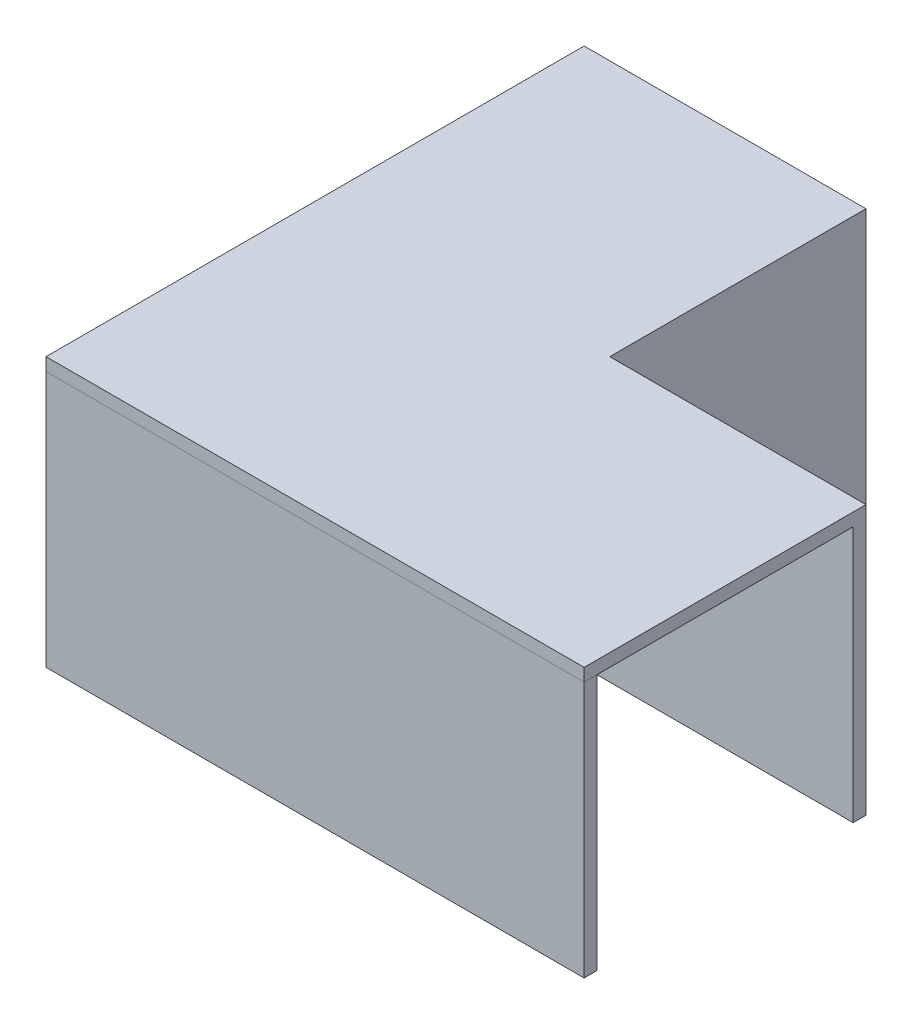
from build123d import *

# Parameters (mm, degrees)
BOSS_EXTRUDE1_DEPTH = 254
SKETCH2_W           = 254
SKETCH2_H           = 254
CUT_EXTRUDE1_DEPTH  = 254
SKETCH3_W           = 254
SKETCH3_H           = 254
CUT_EXTRUDE2_DEPTH  = 254
SKETCH4_W           = 254
SKETCH4_H           = 266.7
SKETCH4_H_2         = 12.7
BOSS_EXTRUDE2_DEPTH = 12.7


with BuildPart() as part:
    # Sketch1 → Boss-Extrude1 (new body)
    with BuildSketch(Plane(origin=(0, 0, 0), x_dir=(1, 0, 0), z_dir=(0, 1, 0))):
        Polygon((-12.7, -12.7), (520.7, -12.7), (520.7, 266.7), (266.7, 266.7), (266.7, 520.7), (-12.7, 520.7), align=None)
        Polygon((0, 0), (508, 0), (508, 254), (254, 254), (254, 508), (0, 508), align=None, mode=Mode.SUBTRACT)
    extrude(amount=BOSS_EXTRUDE1_DEPTH)

    # Sketch2 → Cut-Extrude1 (cut)
    with BuildSketch(Plane.ZY.offset(-508)):
        with Locations((-127, 127)):
            Rectangle(SKETCH2_W, SKETCH2_H)
    extrude(amount=-CUT_EXTRUDE1_DEPTH, mode=Mode.SUBTRACT)

    # Sketch3 → Cut-Extrude2 (cut)
    with BuildSketch(Plane.XY.offset(-508)):
        with Locations((127, 127)):
            Rectangle(SKETCH3_W, SKETCH3_H)
    extrude(amount=-CUT_EXTRUDE2_DEPTH, mode=Mode.SUBTRACT)


with BuildPart() as cut_extrude2_piece_1:
    # of the separate pieces the step leaves, piece 1, a body of its own (cut_extrude2_pieces)
    add(part.part.solids().sort_by_distance((-12.7, 0, 12.7))[0])


with BuildPart() as cut_extrude2_piece_2:
    # of the separate pieces the step leaves, piece 2, a body of its own (cut_extrude2_pieces)
    add(part.part.solids().sort_by_distance((266.7, 0, -520.7))[0])

    # Sketch4 → Boss-Extrude2 (add)
    with BuildSketch(Plane(origin=(0, 254, 0), x_dir=(1, 0, 0), z_dir=(0, 1, 0))):
        Polygon((266.7, 520.7), (0, 520.7), (0, 0), (266.7, 0), (266.7, 266.7), align=None)
        with Locations((393.7, 133.35)):
            Rectangle(SKETCH4_W, SKETCH4_H)
        Polygon((0, 520.7), (-12.7, 520.7), (-12.7, -12.7), (266.7, -12.7), (266.7, 0), (0, 0), align=None)
        with Locations((393.7, -6.35)):
            Rectangle(SKETCH4_W, SKETCH4_H_2)
    extrude(amount=BOSS_EXTRUDE2_DEPTH)


solid = Compound([cut_extrude2_piece_1.part, cut_extrude2_piece_2.part])
